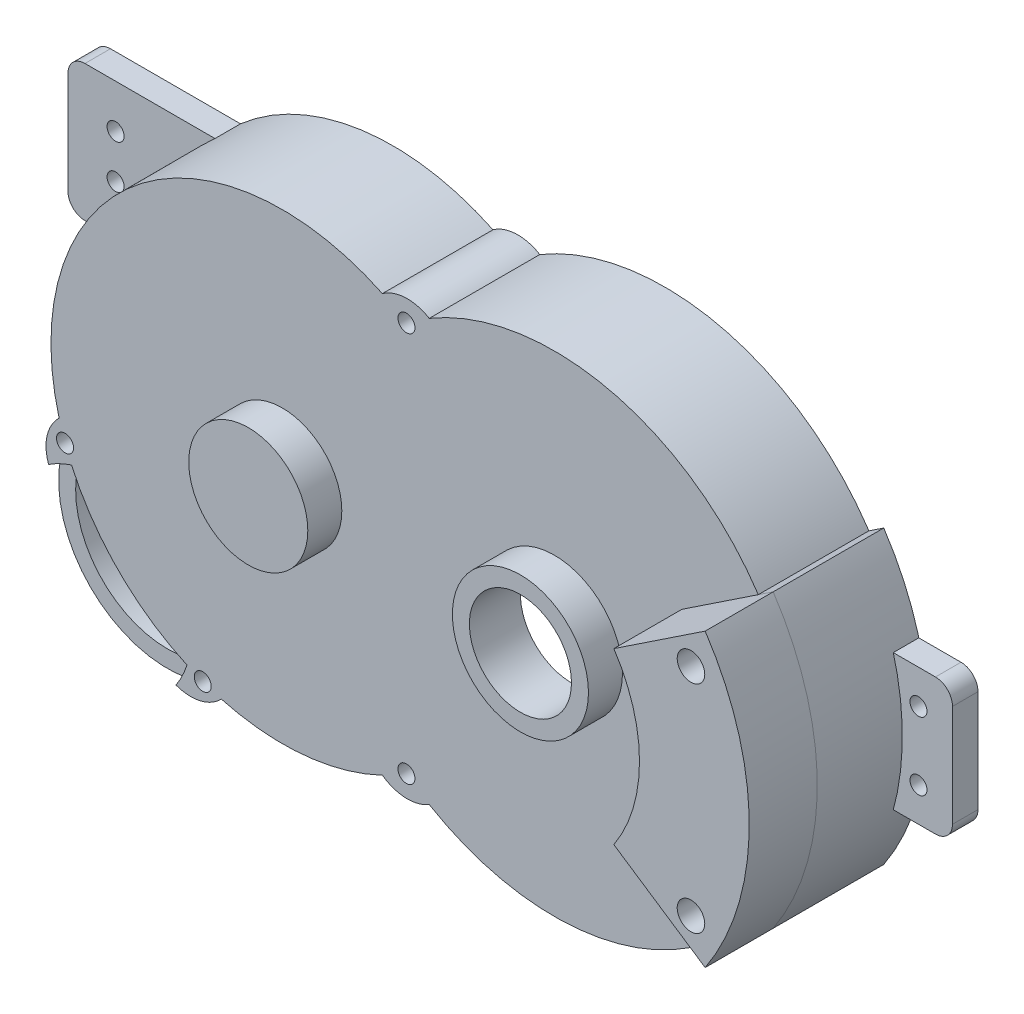
from build123d import *
from build123d.topology import SkipClean

# Parameters (mm, degrees)
SKETCH1_R            = 12.5
SKETCH1_R_2          = 15
BOSS_EXTRUDE5_DEPTH  = 5
SKETCH1_10_R         = 2.5
BOSS_EXTRUDE6_DEPTH  = 32.5
SKETCH1_11_R         = 2.5
CUT_EXTRUDE3_DEPTH   = 25
BOSS_EXTRUDE7_START  = 10
SKETCH1_12_R         = 17.5
SKETCH1_12_R_2       = 20
SKETCH1_12_R_3       = 15
BOSS_EXTRUDE7_DEPTH  = 10
CUT_EXTRUDE4_START   = 5
CUT_EXTRUDE4_DEPTH   = 5
SKETCH1_14_R         = 15
BOSS_EXTRUDE8_DEPTH  = 5
BOSS_EXTRUDE18_DEPTH = 30
CUT_EXTRUDE6_DEPTH   = 25
CUT_EXTRUDE7_DEPTH   = 20
SKETCH1_17_R         = 2.5
BOSS_EXTRUDE19_DEPTH = 32.5
SKETCH1_18_R         = 2.5
CUT_EXTRUDE8_DEPTH   = 25
SKETCH5_R            = 4.05
BOSS_EXTRUDE23_DEPTH = 20
SKETCH5_7_R          = 4.05
BOSS_EXTRUDE24_DEPTH = 10
BOSS_EXTRUDE25_DEPTH = 32.5


with BuildPart() as part:
    # Sketch1 → Boss-Extrude5 (new body)
    with BuildSketch(Plane.XY):
        with BuildLine():
            ThreePointArc((-43.25, 51.17067031), (-85.050895255, 62.797201029), (-124.456158067, 44.639108525))
            ThreePointArc((-124.456158067, 44.639108525), (-142.061021018, 10.836497137), (-136.953211864, -26.931982072))
            ThreePointArc((-136.953211864, -26.931982072), (-152.831998462, -72.831998462), (-106.931982072, -56.953211864))
            ThreePointArc((-106.931982072, -56.953211864), (-74.302823883, -62.741869468), (-43.25, -51.17067031))
            ThreePointArc((-43.25, -51.17067031), (67, 0), (-43.25, 51.17067031))
        make_face()
        with Locations((-80, 0)):
            Circle(SKETCH1_R, mode=Mode.SUBTRACT)
        with Locations((-133.74011537, -53.74011537)):
            Circle(SKETCH1_R_2, mode=Mode.SUBTRACT)
        Circle(SKETCH1_R_2, mode=Mode.SUBTRACT)
    extrude(amount=-BOSS_EXTRUDE5_DEPTH)

    # Sketch1<10> → Boss-Extrude6 (add)
    with BuildSketch(Plane.XY):
        with BuildLine():
            ThreePointArc((-127.98442458, 48.181894916), (-145.705818757, 17.514148036), (-145.600267844, -17.905442155))
            ThreePointArc((-145.600267844, -17.905442155), (-148.223407914, -21.525256537), (-149.405122728, -25.836575371))
            ThreePointArc((-149.405122728, -25.836575371), (-156.367532368, -76.367532368), (-105.836575371, -69.405122728))
            ThreePointArc((-105.836575371, -69.405122728), (-101.525256538, -68.223407914), (-97.905442155, -65.600267844))
            ThreePointArc((-97.905442155, -65.600267844), (-73.850667048, -67.721382917), (-50.571382583, -61.302173509))
            ThreePointArc((-50.571382583, -61.302173509), (-43.775658453, -63.659612747), (-36.80587195, -61.881562601))
            ThreePointArc((-36.80587195, -61.881562601), (26.463528319, -66.9602992), (69.166465863, -20))
            Line((69.166465863, -20), (87, -20))
            ThreePointArc((87, -20), (90.535533906, -18.535533906), (92, -15))
            Line((92, -15), (92, 15))
            ThreePointArc((92, 15), (90.535533906, 18.535533906), (87, 20))
            Line((87, 20), (69.166465863, 20))
            ThreePointArc((69.166465863, 20), (26.463528319, 66.9602992), (-36.80587195, 61.881562601))
            ThreePointArc((-36.80587195, 61.881562601), (-43.775658453, 63.659612747), (-50.571382583, 61.302173509))
            ThreePointArc((-50.571382583, 61.302173509), (-91.362874745, 67.043904104), (-127.98442458, 48.181894916))
        make_face()
        with Locations((-103.38049856, -63.85414855)):
            Circle(SKETCH1_10_R, mode=Mode.SUBTRACT)
        with Locations((-43.5, -57.373774497)):
            Circle(SKETCH1_10_R, mode=Mode.SUBTRACT)
        with Locations((-143.85414855, -23.38049856)):
            Circle(SKETCH1_10_R, mode=Mode.SUBTRACT)
        with BuildLine():
            ThreePointArc((-136.953211864, -26.931982072), (-142.061021018, 10.836497137), (-124.456158067, 44.639108525))
            ThreePointArc((-124.456158067, 44.639108525), (-85.050895255, 62.797201029), (-43.25, 51.17067031))
            ThreePointArc((-43.25, 51.17067031), (67, 0), (-43.25, -51.17067031))
            ThreePointArc((-43.25, -51.17067031), (-74.302823883, -62.741869468), (-106.931982072, -56.953211864))
            ThreePointArc((-106.931982072, -56.953211864), (-152.831998462, -72.831998462), (-136.953211864, -26.931982072))
        make_face(mode=Mode.SUBTRACT)
        with Locations((-43.5, 57.373774497)):
            Circle(SKETCH1_10_R, mode=Mode.SUBTRACT)
        with Locations((82, 10)):
            Circle(SKETCH1_10_R, mode=Mode.SUBTRACT)
        with Locations((82, -10)):
            Circle(SKETCH1_10_R, mode=Mode.SUBTRACT)
    extrude(amount=-BOSS_EXTRUDE6_DEPTH)

    # Sketch1<11> → Cut-Extrude3 (cut)
    with SkipClean():  # the faces are left unmerged after this step: merging them gives an invalid solid
        with BuildSketch(Plane.XY):
            with BuildLine():
                Line((87, 20), (69.166465863, 20))
                ThreePointArc((69.166465863, 20), (72, 0), (69.166465863, -20))
                Line((69.166465863, -20), (87, -20))
                ThreePointArc((87, -20), (90.535533906, -18.535533906), (92, -15))
                Line((92, -15), (92, 0))
                Line((92, 0), (92, 15))
                ThreePointArc((92, 15), (90.535533906, 18.535533906), (87, 20))
            make_face()
            with Locations((82, -10)):
                Circle(SKETCH1_11_R, mode=Mode.SUBTRACT)
            with Locations((82, 10)):
                Circle(SKETCH1_11_R, mode=Mode.SUBTRACT)
        extrude(amount=-CUT_EXTRUDE3_DEPTH, mode=Mode.SUBTRACT)

    # Sketch1<12> → Boss-Extrude7 (add)
    # profile 1 of 2: a face of its own
    with SkipClean():  # the faces are left unmerged after this step: merging them gives an invalid solid
        with BuildSketch(Plane.XY.offset(BOSS_EXTRUDE7_START)):
            with Locations((-80, 0)):
                Circle(SKETCH1_12_R)
        # profile 2 of 2: a face of its own
        with BuildSketch(Plane.XY.offset(BOSS_EXTRUDE7_START)):
            Circle(SKETCH1_12_R_2)
            Circle(SKETCH1_12_R_3, mode=Mode.SUBTRACT)
        extrude(amount=-BOSS_EXTRUDE7_DEPTH)

    # Sketch1<13> → Cut-Extrude4 (cut)
    with SkipClean():  # the faces are left unmerged after this step: merging them gives an invalid solid
        with BuildSketch(Plane.XY.offset(CUT_EXTRUDE4_START)):
            with BuildLine():
                ThreePointArc((-67.5, 0), (-75.204602651, 11.543576754), (-88.820666283, 8.856965977))
                ThreePointArc((-88.820666283, 8.856965977), (-84.795397349, -11.543576754), (-67.5, 0))
            make_face()
        extrude(amount=-CUT_EXTRUDE4_DEPTH, mode=Mode.SUBTRACT)

    # Sketch1<14> → Boss-Extrude8 (add)
    with SkipClean():  # the faces are left unmerged after this step: merging them gives an invalid solid
        with BuildSketch(Plane.XY):
            with Locations((-133.74011537, -53.74011537)):
                Circle(SKETCH1_14_R)
        extrude(amount=-BOSS_EXTRUDE8_DEPTH)

    # Sketch3 → Boss-Extrude18 (add)
    with SkipClean():  # the faces are left unmerged after this step: merging them gives an invalid solid
        with BuildSketch(Plane.XY):
            with BuildLine():
                ThreePointArc((-136.953211864, -26.931982072), (-152.831998462, -72.831998462), (-106.931982072, -56.953211864))
                ThreePointArc((-106.931982072, -56.953211864), (-124.547727215, -44.547727215), (-136.953211864, -26.931982072))
            make_face()
        extrude(amount=-BOSS_EXTRUDE18_DEPTH)

    # Sketch3<3> → Cut-Extrude6 (cut)
    with SkipClean():  # the faces are left unmerged after this step: merging them gives an invalid solid
        with BuildSketch(Plane.XY):
            with BuildLine():
                ThreePointArc((-108.021177933, -61.958159973), (-128.083261121, -48.083261121), (-141.958159973, -28.021177933))
                ThreePointArc((-141.958159973, -28.021177933), (-152.831998462, -72.831998462), (-108.021177933, -61.958159973))
            make_face()
        extrude(amount=-CUT_EXTRUDE6_DEPTH, mode=Mode.SUBTRACT)

    # Sketch4 → Cut-Extrude7 (cut)
    with SkipClean():  # the faces are left unmerged after this step: merging them gives an invalid solid
        with BuildSketch(Plane.XY):
            with BuildLine():
                ThreePointArc((-149.405122728, -25.836575371), (-149.343528932, -28.584266239), (-148.682949629, -31.252080678))
                ThreePointArc((-148.682949629, -31.252080678), (-152.831998462, -72.831998462), (-111.252080678, -68.682949629))
                ThreePointArc((-111.252080678, -68.682949629), (-108.584266239, -69.343528932), (-105.836575371, -69.405122728))
                ThreePointArc((-105.836575371, -69.405122728), (-156.367532368, -76.367532368), (-149.405122728, -25.836575371))
            make_face()
        extrude(amount=-CUT_EXTRUDE7_DEPTH, mode=Mode.SUBTRACT)

    # Sketch1<17> → Boss-Extrude19 (add)
    with SkipClean():  # the faces are left unmerged after this step: merging them gives an invalid solid
        with BuildSketch(Plane.XY):
            with BuildLine():
                ThreePointArc((-147.07619641, 11.17067031), (-140.433387398, 31.173798094), (-127.98442458, 48.181894916))
                ThreePointArc((-127.98442458, 48.181894916), (-126.408032467, 49.702057529), (-124.783507009, 51.17067031))
                Line((-124.783507009, 51.17067031), (-163, 51.17067031))
                ThreePointArc((-163, 51.17067031), (-166.535533906, 49.706204216), (-168, 46.17067031))
                Line((-168, 46.17067031), (-168, 16.17067031))
                ThreePointArc((-168, 16.17067031), (-166.535533906, 12.635136404), (-163, 11.17067031))
                Line((-163, 11.17067031), (-147.07619641, 11.17067031))
            make_face()
            with Locations((-154, 25.585335155)):
                Circle(SKETCH1_17_R, mode=Mode.SUBTRACT)
            with Locations((-154, 38.378002733)):
                Circle(SKETCH1_17_R, mode=Mode.SUBTRACT)
        extrude(amount=-BOSS_EXTRUDE19_DEPTH)

    # Sketch1<18> → Cut-Extrude8 (cut)
    with SkipClean():  # the faces are left unmerged after this step: merging them gives an invalid solid
        with BuildSketch(Plane.XY):
            with BuildLine():
                ThreePointArc((-147.07619641, 11.17067031), (-140.433387398, 31.173798094), (-127.98442458, 48.181894916))
                ThreePointArc((-127.98442458, 48.181894916), (-126.408032467, 49.702057529), (-124.783507009, 51.17067031))
                Line((-124.783507009, 51.17067031), (-163, 51.17067031))
                ThreePointArc((-163, 51.17067031), (-166.535533906, 49.706204216), (-168, 46.17067031))
                Line((-168, 46.17067031), (-168, 16.17067031))
                ThreePointArc((-168, 16.17067031), (-166.535533906, 12.635136404), (-163, 11.17067031))
                Line((-163, 11.17067031), (-147.07619641, 11.17067031))
            make_face()
            with Locations((-154, 25.585335155)):
                Circle(SKETCH1_18_R, mode=Mode.SUBTRACT)
            with Locations((-154, 38.378002733)):
                Circle(SKETCH1_18_R, mode=Mode.SUBTRACT)
        extrude(amount=-CUT_EXTRUDE8_DEPTH, mode=Mode.SUBTRACT)

    # Sketch5 → Boss-Extrude23 (add)
    with BuildSketch(Plane.XY):
        with BuildLine():
            ThreePointArc((37.453775308, 24.944232102), (45, 0), (37.453775308, -24.944232102))
            Line((37.453775308, -24.944232102), (64.303970673, -42.826474938))
            ThreePointArc((64.303970673, -42.826474938), (77.26, 0), (64.303970673, 42.826474938))
            Line((64.303970673, 42.826474938), (37.453775308, 24.944232102))
        make_face()
        with Locations((60.1326, 31.75)):
            Circle(SKETCH5_R, mode=Mode.SUBTRACT)
        with Locations((60.1326, -31.75)):
            Circle(SKETCH5_R, mode=Mode.SUBTRACT)
    extrude(amount=BOSS_EXTRUDE23_DEPTH)

    # Sketch5<7> → Boss-Extrude24 (add)
    with BuildSketch(Plane.XY):
        with Locations((60.1326, -31.75)):
            Circle(SKETCH5_7_R)
        with Locations((60.1326, 31.75)):
            Circle(SKETCH5_7_R)
    extrude(amount=BOSS_EXTRUDE24_DEPTH)


with BuildPart() as body_2:
    # Sketch5<8> → Boss-Extrude25 (new body)
    with BuildSketch(Plane.XY):
        with BuildLine():
            ThreePointArc((63.362621042, -34.193248671), (61.710582822, -37.091831551), (59.926040493, -39.910771364))
            Line((59.926040493, -39.910771364), (64.303970673, -42.826474938))
            ThreePointArc((64.303970673, -42.826474938), (77.26, 0), (64.303970673, 42.826474938))
            Line((64.303970673, 42.826474938), (59.926040493, 39.910771364))
            ThreePointArc((59.926040493, 39.910771364), (61.710582822, 37.091831551), (63.362621042, 34.193248671))
            ThreePointArc((63.362621042, 34.193248671), (63.714029978, 33.640994266), (63.971883257, 33.039342495))
            ThreePointArc((63.971883257, 33.039342495), (72, 0), (63.971883257, -33.039342495))
            ThreePointArc((63.971883257, -33.039342495), (63.714029978, -33.640994266), (63.362621042, -34.193248671))
        make_face()
    extrude(amount=-BOSS_EXTRUDE25_DEPTH)


solid = Compound([part.part, body_2.part])
